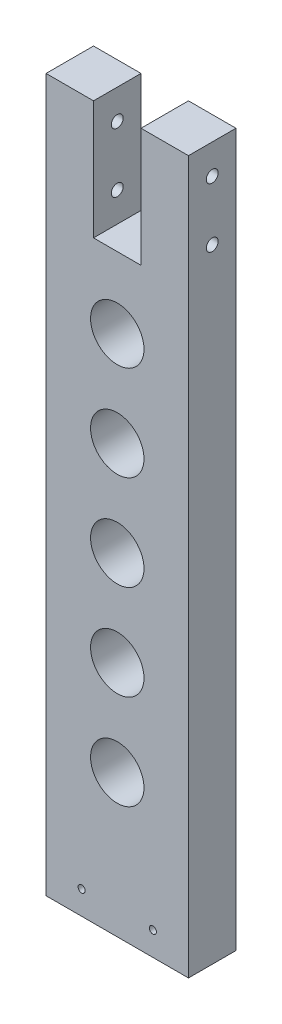
from build123d import *

# Parameters (mm, degrees)
SKIZZE1_W                            = 60
SKIZZE1_H                            = 20
AUFSATZ_LINEAR_AUSTRAGEN1_DEPTH      = 300
SKIZZE2_W                            = 20
SKIZZE2_H                            = 50
SCHNITT_LINEAR_AUSTRAGEN1_DEPTH      = 303.158898595
SKIZZE3_R                            = 11.25
SCHNITT_LINEAR_AUSTRAGEN2_DEPTH      = 300
SKIZZE7_R                            = 1.5
SCHNITT_LINEAR_AUSTRAGEN6_DEPTH      = 303.158898595
SCHNITT_LINEAR_AUSTRAGEN8_DEPTH      = 303.820078595
SCHNITT_LINEAR_AUSTRAGEN8_DEPTH_BACK = 303.820078595
SKIZZE10_R                           = 2.5


with BuildPart() as part:
    # Skizze1 → Aufsatz-Linear austragen1 (new body)
    with BuildSketch(Plane(origin=(0, 0, 0), x_dir=(1, 0, 0), z_dir=(0, 1, 0))):
        Rectangle(SKIZZE1_W, SKIZZE1_H)
    extrude(amount=AUFSATZ_LINEAR_AUSTRAGEN1_DEPTH)

    # Skizze2 → Schnitt-Linear austragen1 (cut, through all)
    with BuildSketch(Plane.XY.offset(10)):
        with Locations((0, 275)):
            Rectangle(SKIZZE2_W, SKIZZE2_H)
    extrude(amount=-SCHNITT_LINEAR_AUSTRAGEN1_DEPTH, mode=Mode.SUBTRACT)

    # Skizze3 → Schnitt-Linear austragen2 (cut)
    with BuildSketch(Plane.XY.offset(10)):
        with Locations((0, 220)):
            Circle(SKIZZE3_R)
        with Locations((0, 180)):
            Circle(SKIZZE3_R)
        with Locations((0, 140)):
            Circle(SKIZZE3_R)
        with Locations((0, 100)):
            Circle(SKIZZE3_R)
        with Locations((0, 60)):
            Circle(SKIZZE3_R)
    extrude(amount=-SCHNITT_LINEAR_AUSTRAGEN2_DEPTH, mode=Mode.SUBTRACT)

    # Skizze7 → Schnitt-Linear austragen6 (cut, through all)
    with BuildSketch(Plane.XY.offset(10)):
        with Locations((-15, 10)):
            Circle(SKIZZE7_R)
        with Locations((15, 10)):
            Circle(SKIZZE7_R)
    extrude(amount=-SCHNITT_LINEAR_AUSTRAGEN6_DEPTH, mode=Mode.SUBTRACT)

    # Skizze10 → Schnitt-Linear austragen8 (cut, two sides: drawn at the far end of the back side and taken through both)
    with BuildSketch(Plane(origin=(-10, 0, 0), x_dir=(0, 0, -1), z_dir=(1, 0, 0)).offset(-SCHNITT_LINEAR_AUSTRAGEN8_DEPTH_BACK)):
        with Locations((0, 262.5)):
            Circle(SKIZZE10_R)
        with Locations((0, 287.5)):
            Circle(SKIZZE10_R)
    extrude(amount=SCHNITT_LINEAR_AUSTRAGEN8_DEPTH + SCHNITT_LINEAR_AUSTRAGEN8_DEPTH_BACK, mode=Mode.SUBTRACT)


solid = part.part
